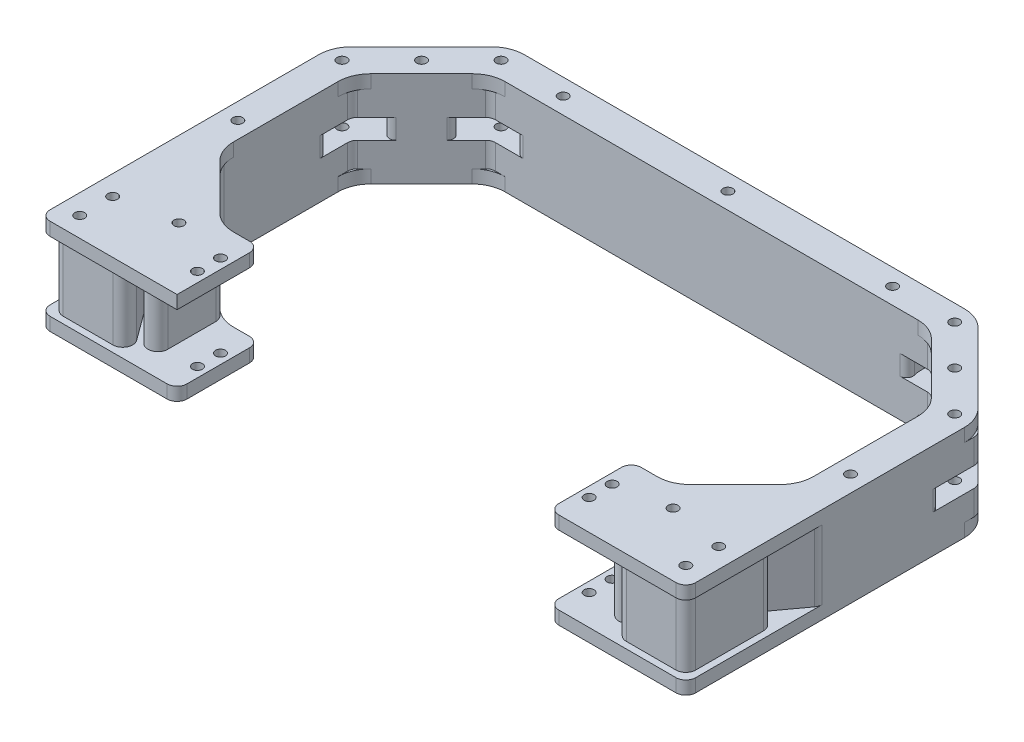
from build123d import *
from OCP.BRepFilletAPI import BRepFilletAPI_MakeFillet

# Parameters (mm, degrees)
EXTRUDE_1_DEPTH           = 21
EXTRUDE_2_DEPTH           = 4
FILLET_14_R1              = 3
FILLET_14_R2              = 10
PATTERN_LINEAR_1_COUNT    = 2
PATTERN_LINEAR_1_PITCH    = 25
SKETCH_27_W               = 12
SKETCH_27_H               = 25
CUT_EXTRUDE_13_DEPTH      = 136.893190035
SKETCH_38_R               = 1.5
CUT_EXTRUDE_16_DEPTH      = 137.685621401
FILLET_13_R               = 3
CUT_EXTRUDE_START         = -25
SKETCH_40_R               = 2.15
CUT_EXTRUDE_18_DEPTH      = 25
SKETCH_41_R               = 1.5
CUT_EXTRUDE_19_DEPTH      = 39
CUT_EXTRUDE_20_DEPTH      = 3
CUT_EXTRUDE_20_DEPTH_BACK = 3
SKETCH_42_R               = 10
FILLET_15_R               = 2
CUT_EXTRUDE_21_DEPTH      = 137.685621401
CUT_EXTRUDE_21_DEPTH_BACK = 137.685621401
SKETCH_47_R               = 1.5
CUT_EXTRUDE_22_DEPTH      = 137.685621401
CUT_EXTRUDE_22_DEPTH_BACK = 137.685621401
SKETCH_48_R               = 1.5
EXTRUDE_3_DEPTH           = 4
EXTRUDE_4_DEPTH           = 4
SKETCH_52_R               = 1.5
EXTRUDE_6_DEPTH           = 21
CUT_EXTRUDE_23_DEPTH      = 137.685621401
CUT_EXTRUDE_23_DEPTH_BACK = 137.685621401
SKETCH_53_R               = 1.5
FILLET_16_R               = 3


with BuildPart() as part:
    # 草图1 → 凸台-拉伸1 (new body)
    with BuildSketch(Plane(origin=(0, 0, 0), x_dir=(1, 0, 0), z_dir=(0, 1, 0))):
        Polygon((-56.45, 0), (-68.45, 0), (-88, 19.55), (-88, 59.55), (-66.786796564, 80.763203436), (0, 80.763203436), (66.786796564, 80.763203436), (88, 59.55), (88, 19.55), (68.45, 0), (56.45, 0), (56.45, -10), (56.45, -25), (68.45, -25), (98, 15.407864376), (98, 63.692135624), (70.928932188, 90.763203436), (0, 90.763203436), (-70.928932188, 90.763203436), (-98, 63.692135624), (-98, 15.407864376), (-68.45, -25), (-56.45, -25), (-56.45, -10), align=None)
    extrude(amount=EXTRUDE_1_DEPTH)

    # 草图27 → 切除-拉伸13 (cut, through all)
    with BuildSketch(Plane(origin=(0, 21, 0), x_dir=(1, 0, 0), z_dir=(0, 1, 0))):
        with Locations((-62.45, -12.5)):
            Rectangle(SKETCH_27_W, SKETCH_27_H)
        with Locations((62.45, -12.5)):
            Rectangle(SKETCH_27_W, SKETCH_27_H)
    extrude(amount=-CUT_EXTRUDE_13_DEPTH, mode=Mode.SUBTRACT)


with BuildPart() as body_2:
    # 草图6 → 凸台-拉伸2 (new body)
    with BuildSketch(Plane(origin=(0, 21, 0), x_dir=(1, 0, 0), z_dir=(0, 1, 0))):
        Polygon((-56.45, -25), (-56.45, 0), (-68.45, 0), (-88, 19.55), (-88, 59.55), (-66.786796564, 80.763203436), (66.786796564, 80.763203436), (88, 59.55), (88, 19.55), (68.45, 0), (56.45, 0), (56.45, -25), (68.45, -25), (98, 15.407864376), (98, 63.692135624), (70.928932188, 90.763203436), (-70.928932188, 90.763203436), (-98, 63.692135624), (-98, 15.407864376), (-68.45, -25), align=None)
    extrude(amount=EXTRUDE_2_DEPTH)

    # 圆角14: one fillet with a radius per group of edges: ONE call of the kernel's fillet builder (fillet() takes one radius for all edges)
    fillet_14_edges_1 = [body_2.edges().sort_by_distance(p)[0] for p in [
        (-56.45, 23, 0),
        (56.45, 23, 0),
    ]]
    fillet_14_edges_2 = [body_2.edges().sort_by_distance(p)[0] for p in [
        (-68.45, 23, 0),
        (-88, 23, -19.55),
        (-88, 23, -59.55),
        (-66.786796564, 23, -80.763203436),
        (66.786796564, 23, -80.763203436),
        (88, 23, -59.55),
        (88, 23, -19.55),
        (68.45, 23, 0),
        (98, 23, -63.692135624),
        (70.928932188, 23, -90.763203436),
        (-70.928932188, 23, -90.763203436),
        (-98, 23, -63.692135624),
    ]]
    fillet_14 = BRepFilletAPI_MakeFillet(body_2.part.solid().wrapped)
    for e in fillet_14_edges_1:
        fillet_14.Add(FILLET_14_R1, e.wrapped)
    for e in fillet_14_edges_2:
        fillet_14.Add(FILLET_14_R2, e.wrapped)
    add(Compound.cast(fillet_14.Shape()), mode=Mode.REPLACE)


with BuildPart() as pattern_linear_1_1:
    # 阵列(线性)1: pattern copy
    add(body_2.part.moved(Location(Vector(0, -1, 0) * (1 * PATTERN_LINEAR_1_PITCH))))


with BuildPart() as cut_extrude_16_tool:
    # 草图38 → 切除-拉伸16 (new, through all)
    with BuildSketch(Plane(origin=(0, 25, 0), x_dir=(1, 0, 0), z_dir=(0, 1, 0))):
        with Locations(Location((0, 85.763203436, 0), (0, 0, 270))):
            Circle(SKETCH_38_R)
        with Locations(Location((-50, 85.763203436, 0), (0, 0, 270))):
            Circle(SKETCH_38_R)
        with Locations(Location((-80.928932188, 73.692135624, 0), (0, 0, 270))):
            Circle(SKETCH_38_R)
        with Locations(Location((-93, 30, 0), (0, 0, 270))):
            Circle(SKETCH_38_R)
        with Locations(Location((-75, -5.878809602, 0), (0, 0, 270))):
            Circle(SKETCH_38_R)
        with Locations(Location((75, -5.878809602, 0), (0, 0, 270))):
            Circle(SKETCH_38_R)
        with Locations(Location((93, 30, 0), (0, 0, 270))):
            Circle(SKETCH_38_R)
        with Locations(Location((80.928932188, 73.692135624, 0), (0, 0, 270))):
            Circle(SKETCH_38_R)
        with Locations(Location((50, 85.763203436, 0), (0, 0, 270))):
            Circle(SKETCH_38_R)
    extrude(amount=-CUT_EXTRUDE_16_DEPTH)


with BuildPart() as part_1:
    add(part.part)

    # 切除-拉伸16: cut by cut_extrude_16_tool
    add(cut_extrude_16_tool.part, mode=Mode.SUBTRACT)

    # 圆角13
    fillet_13_edges = [part_1.edges().sort_by_distance(p)[0] for p in [
        (-68.45, 10.5, 25),
        (-98, 10.5, -63.692135624),
        (-70.928932188, 10.5, -90.763203436),
        (70.928932188, 10.5, -90.763203436),
        (98, 10.5, -63.692135624),
        (98, 10.5, -15.407864376),
        (68.45, 10.5, 25),
        (68.45, 10.5, 0),
        (88, 10.5, -19.55),
        (88, 10.5, -59.55),
        (66.786796564, 10.5, -80.763203436),
        (-66.786796564, 10.5, -80.763203436),
        (-88, 10.5, -59.55),
        (-88, 10.5, -19.55),
        (-68.45, 10.5, 0),
    ]]
    fillet(fillet_13_edges, radius=FILLET_13_R)


with BuildPart() as body_2_1:
    add(body_2.part)

    # 切除-拉伸16: cut by cut_extrude_16_tool
    add(cut_extrude_16_tool.part, mode=Mode.SUBTRACT)


with BuildPart() as pattern_linear_1_1_1:
    add(pattern_linear_1_1.part)

    # 切除-拉伸16: cut by cut_extrude_16_tool
    add(cut_extrude_16_tool.part, mode=Mode.SUBTRACT)


with BuildPart() as cut_extrude_18_tool:
    # 草图40 → 切除-拉伸18 (new body)
    with BuildSketch(Plane.XZ.offset(4).offset(CUT_EXTRUDE_START)):
        with Locations(Location((75, 5.878809602, 0), (0, 0, 270))):
            Circle(SKETCH_40_R)
        with Locations(Location((93, -30, 0), (0, 0, 270))):
            Circle(SKETCH_40_R)
        with Locations(Location((80.928932188, -73.692135624, 0), (0, 0, 270))):
            Circle(SKETCH_40_R)
        with Locations(Location((50, -85.763203436, 0), (0, 0, 270))):
            Circle(SKETCH_40_R)
        with Locations(Location((0, -85.763203436, 0), (0, 0, 270))):
            Circle(SKETCH_40_R)
        with Locations(Location((-50, -85.763203436, 0), (0, 0, 270))):
            Circle(SKETCH_40_R)
        with Locations(Location((-80.928932188, -73.692135624, 0), (0, 0, 270))):
            Circle(SKETCH_40_R)
        with Locations(Location((-93, -30, 0), (0, 0, 270))):
            Circle(SKETCH_40_R)
        with Locations(Location((-75, 5.878809602, 0), (0, 0, 270))):
            Circle(SKETCH_40_R)
    extrude(amount=CUT_EXTRUDE_18_DEPTH)


with BuildPart() as part_2:
    add(part_1.part)

    # 切除-拉伸18: cut by cut_extrude_18_tool
    add(cut_extrude_18_tool.part, mode=Mode.SUBTRACT)


with BuildPart() as pattern_linear_1_1_2:
    add(pattern_linear_1_1_1.part)

    # 切除-拉伸18: cut by cut_extrude_18_tool
    add(cut_extrude_18_tool.part, mode=Mode.SUBTRACT)


with BuildPart() as cut_extrude_19_tool:
    # 草图41 → 切除-拉伸19 (new body)
    with BuildSketch(Plane(origin=(0, 25, 0), x_dir=(1, 0, 0), z_dir=(0, 1, 0))):
        with Locations(Location((-68.857864376, 85.763203436, 0), (0, 0, 270))):
            Circle(SKETCH_41_R)
        with Locations(Location((-93, 61.621067812, 0), (0, 0, 270))):
            Circle(SKETCH_41_R)
        with Locations(Location((93, 61.621067812, 0), (0, 0, 270))):
            Circle(SKETCH_41_R)
        with Locations(Location((68.857864376, 85.763203436, 0), (0, 0, 270))):
            Circle(SKETCH_41_R)
    extrude(amount=-CUT_EXTRUDE_19_DEPTH)


with BuildPart() as part_3:
    add(part_2.part)

    # 切除-拉伸19: cut by cut_extrude_19_tool
    add(cut_extrude_19_tool.part, mode=Mode.SUBTRACT)

    # 草图42 → 切除-拉伸20 (cut, two sides: drawn at the far end of the back side and taken through both)
    with BuildSketch(Plane(origin=(0, 10.5, 0), x_dir=(1, 0, 0), z_dir=(0, 1, 0)).offset(-CUT_EXTRUDE_20_DEPTH_BACK)):
        with Locations((-93, 61.621067812)):
            Circle(SKETCH_42_R)
        with Locations((-68.857864376, 85.763203436)):
            Circle(SKETCH_42_R)
        with Locations((68.857864376, 85.763203436)):
            Circle(SKETCH_42_R)
        with Locations((93, 61.621067812)):
            Circle(SKETCH_42_R)
    extrude(amount=CUT_EXTRUDE_20_DEPTH + CUT_EXTRUDE_20_DEPTH_BACK, mode=Mode.SUBTRACT)

    # 圆角15
    fillet_15_edges = [part_3.edges().sort_by_distance(p)[0] for p in [
        (-98, 10.5, -52.960813774),
        (-78.517122639, 10.5, -83.175012985),
        (60.197610338, 10.5, -90.763203436),
        (90.411809549, 10.5, -71.280326075),
        (-88, 10.5, -52.960813774),
        (-83.340741737, 10.5, -64.209258263),
        (-90.411809549, 10.5, -71.280326075),
        (-71.446054827, 10.5, -76.103945173),
        (-60.197610338, 10.5, -80.763203436),
        (-60.197610338, 10.5, -90.763203436),
        (60.197610338, 10.5, -80.763203436),
        (71.446054827, 10.5, -76.103945173),
        (78.517122639, 10.5, -83.175012985),
        (83.340741737, 10.5, -64.209258263),
        (88, 10.5, -52.960813774),
        (98, 10.5, -52.960813774),
    ]]
    fillet(fillet_15_edges, radius=FILLET_15_R)



with BuildPart() as body_2_2:
    add(body_2_1.part)

    # 切除-拉伸19: cut by cut_extrude_19_tool
    add(cut_extrude_19_tool.part, mode=Mode.SUBTRACT)


with BuildPart() as pattern_linear_1_1_3:
    add(pattern_linear_1_1_2.part)

    # 切除-拉伸19: cut by cut_extrude_19_tool
    add(cut_extrude_19_tool.part, mode=Mode.SUBTRACT)


with BuildPart() as cut_extrude_21_tool:
    # 草图47 → 切除-拉伸21 (new, two sides: drawn at the far end of the back side and taken through both)
    with BuildSketch(Plane(origin=(0, 25, 0), x_dir=(1, 0, 0), z_dir=(0, 1, 0)).offset(-CUT_EXTRUDE_21_DEPTH_BACK)):
        with Locations(Location((59.45, -8.815450916, 0), (0, 0, 270))):
            Circle(SKETCH_47_R)
        with Locations(Location((59.45, -15.815450916, 0), (0, 0, 270))):
            Circle(SKETCH_47_R)
    extrude(amount=CUT_EXTRUDE_21_DEPTH + CUT_EXTRUDE_21_DEPTH_BACK)


with BuildPart() as body_2_3:
    add(body_2_2.part)

    # 切除-拉伸21: cut by cut_extrude_21_tool
    add(cut_extrude_21_tool.part, mode=Mode.SUBTRACT)


with BuildPart() as pattern_linear_1_1_4:
    add(pattern_linear_1_1_3.part)

    # 切除-拉伸21: cut by cut_extrude_21_tool
    add(cut_extrude_21_tool.part, mode=Mode.SUBTRACT)


with BuildPart() as cut_extrude_22_tool:
    # 草图48 → 切除-拉伸22 (new, two sides: drawn at the far end of the back side and taken through both)
    with BuildSketch(Plane(origin=(0, 25, 0), x_dir=(1, 0, 0), z_dir=(0, 1, 0)).offset(-CUT_EXTRUDE_22_DEPTH_BACK)):
        with Locations(Location((-59.45, -8.815450916, 0), (0, 0, 270))):
            Circle(SKETCH_48_R)
        with Locations(Location((-59.45, -15.815450916, 0), (0, 0, 270))):
            Circle(SKETCH_48_R)
    extrude(amount=CUT_EXTRUDE_22_DEPTH + CUT_EXTRUDE_22_DEPTH_BACK)


with BuildPart() as body_2_4:
    add(body_2_3.part)

    # 切除-拉伸22: cut by cut_extrude_22_tool
    add(cut_extrude_22_tool.part, mode=Mode.SUBTRACT)


with BuildPart() as pattern_linear_1_1_5:
    add(pattern_linear_1_1_4.part)

    # 切除-拉伸22: cut by cut_extrude_22_tool
    add(cut_extrude_22_tool.part, mode=Mode.SUBTRACT)


with BuildPart() as part_4:
    add(part_3.part)

    add(body_2_4.part)  # 凸台-拉伸3 merges body 2
    # 草图49 → 凸台-拉伸3 (add)
    with BuildSketch(Plane(origin=(0, 25, 0), x_dir=(1, 0, 0), z_dir=(0, 1, 0))):
        Polygon((-68.45, -25), (-98, -25), (-98, 15.407864376), align=None)
        Polygon((98, 15.407864376), (68.45, -25), (98, -25), align=None)
    extrude(amount=-EXTRUDE_3_DEPTH)


    add(pattern_linear_1_1_5.part)  # 凸台-拉伸4 merges 阵列(线性)1_1
    # 草图50 → 凸台-拉伸4 (add)
    with BuildSketch(Plane(origin=(0, 0, 0), x_dir=(1, 0, 0), z_dir=(0, 1, 0))):
        Polygon((-68.45, -25), (-98, -25), (-98, 15.407864376), align=None)
        Polygon((98, -25), (98, 15.407864376), (68.45, -25), align=None)
    extrude(amount=-EXTRUDE_4_DEPTH)

    # 草图52 → 凸台-拉伸6 (add)
    # profile 1 of 2: a face of its own
    with BuildSketch(Plane(origin=(0, 0, 0), x_dir=(1, 0, 0), z_dir=(0, 1, 0))):
        Polygon((96, 9.793054436), (72.018659398, -23), (96, -23), align=None)
        with Locations(Location((92, -19, 0), (0, 0, 270))):
            Circle(SKETCH_52_R, mode=Mode.SUBTRACT)
        with Locations(Location((92, -9, 0), (0, 0, 270))):
            Circle(SKETCH_52_R, mode=Mode.SUBTRACT)
    # profile 2 of 2: a face of its own
    with BuildSketch(Plane(origin=(0, 0, 0), x_dir=(1, 0, 0), z_dir=(0, 1, 0))):
        Polygon((-72.018659398, -23), (-96, -23), (-96, 9.793054436), align=None)
        with Locations(Location((-92, -19, 0), (0, 0, 270))):
            Circle(SKETCH_52_R, mode=Mode.SUBTRACT)
        with Locations(Location((-92, -9, 0), (0, 0, 270))):
            Circle(SKETCH_52_R, mode=Mode.SUBTRACT)
    extrude(amount=EXTRUDE_6_DEPTH)

    # 草图53 → 切除-拉伸23 (cut, two sides: drawn at the far end of the back side and taken through both)
    with BuildSketch(Plane(origin=(0, 25, 0), x_dir=(1, 0, 0), z_dir=(0, 1, 0)).offset(-CUT_EXTRUDE_23_DEPTH_BACK)):
        with Locations(Location((92, -9, 0), (0, 0, 270))):
            Circle(SKETCH_53_R)
        with Locations(Location((92, -19, 0), (0, 0, 270))):
            Circle(SKETCH_53_R)
        with Locations(Location((-92, -9, 0), (0, 0, 270))):
            Circle(SKETCH_53_R)
        with Locations(Location((-92, -19, 0), (0, 0, 270))):
            Circle(SKETCH_53_R)
    extrude(amount=CUT_EXTRUDE_23_DEPTH + CUT_EXTRUDE_23_DEPTH_BACK, mode=Mode.SUBTRACT)

    # 圆角16
    fillet_16_edges = [part_4.edges().sort_by_distance(p)[0] for p in [
        (56.45, -2, 25),
        (-98, -2, 25),
        (-56.45, -2, 25),
        (-98, 23, 25),
        (98, 23, 25),
        (56.45, 23, 25),
        (98, -2, 25),
        (72.018659398, 10.5, 23),
        (96, 10.5, -9.793054436),
        (96, 10.5, 23),
        (-96, 10.5, 23),
        (-96, 10.5, -9.793054436),
        (-72.018659398, 10.5, 23),
    ]]
    fillet(fillet_16_edges, radius=FILLET_16_R)


solid = part_4.part
